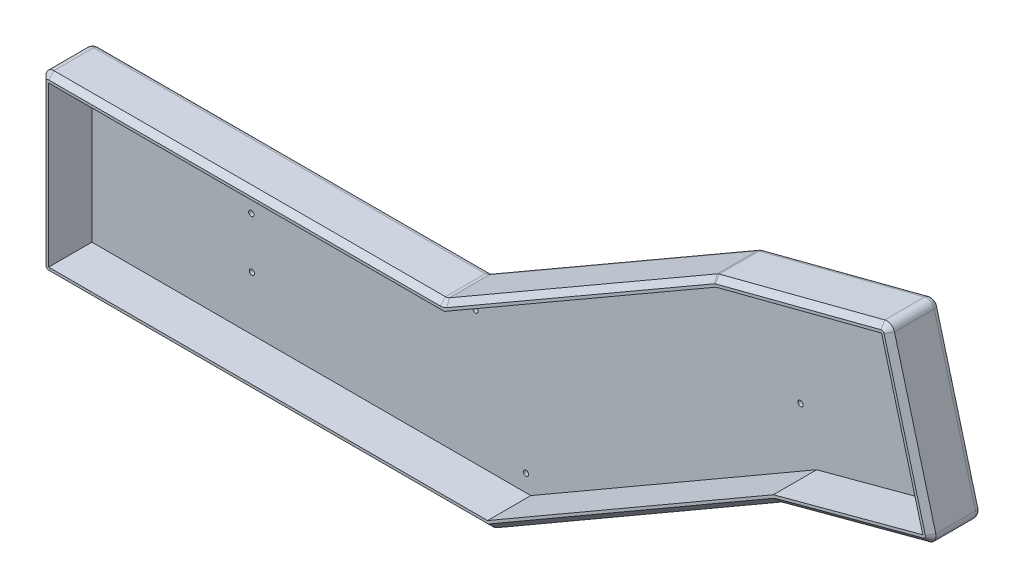
from build123d import *

# Parameters (mm, degrees)
BOSS_EXTRU_1_DEPTH      = 19
CONG_1_R                = 3
ESQUISSE1_R             = 1
BOSS_EXTRU_2_DEPTH      = 2.7
ESQUISSE2_R             = 2
ESQUISSE2_R_2           = 1
ENL_V_MAT_EXTRU_1_DEPTH = 1
CHANFREIN1_SIZE         = 2
CONG_2_R                = 2


with BuildPart() as part:
    # Model → Boss.-Extru.1 (new body)
    with BuildSketch(Plane.XY):
        Polygon((-25.928539703, 10.301582208), (76.096991945, 69.210096437), (141.828136311, 86.310332452), (158.934643692, 22.435471273), (100.081941761, 6.672683012), (-8.057042666, -55.858487698), (-177.373873722, -55.858487698), (-177.373873722, -50.687645053), (-177.373873722, 10.291172324), align=None)
        Polygon((-25.124548608, 7.301637465), (-174.373873722, 7.291378528), (-174.373873722, -50.687645053), (-174.373873722, -52.858487698), (-8.861972593, -52.858487698), (98.923133978, 9.468053786), (155.26069475, 24.557200291), (139.700811798, 82.657041562), (77.245358051, 66.408990356), align=None, mode=Mode.SUBTRACT)
    extrude(amount=BOSS_EXTRU_1_DEPTH)

    # Congé1
    cong_1_edges = [part.edges().sort_by_distance(p)[0] for p in [
        (76.096991945, 69.210096437, 9.5),
        (141.828136311, 86.310332452, 9.5),
        (158.934643692, 22.435471273, 9.5),
        (100.081941761, 6.672683012, 9.5),
        (-8.057042666, -55.858487698, 9.5),
        (-177.373873722, -55.858487698, 9.5),
        (-177.373873722, 10.291172324, 9.5),
        (-25.928539703, 10.301582208, 9.5),
    ]]
    fillet(cong_1_edges, radius=CONG_1_R)

    # Esquisse1 → Boss.-Extru.2 (add)
    with BuildSketch(Plane.XY):
        Polygon((-25.124548608, 7.301637465), (-174.373873722, 7.291378528), (-174.373873722, -50.687645053), (-174.373873722, -52.858487698), (-8.861972593, -52.858487698), (98.923133978, 9.468053786), (155.26069475, 24.557200291), (139.700811798, 82.657041562), (77.245358051, 66.408990356), align=None)
        with Locations(Location((-114.259444544, -13.418125698, 0), (0, 0, 180))):
            Circle(ESQUISSE1_R, mode=Mode.SUBTRACT)
        with Locations(Location((-114.030844544, -32.493525698, 0), (0, 0, 180))):
            Circle(ESQUISSE1_R, mode=Mode.SUBTRACT)
        with Locations(Location((-29.702844544, -2.648525698, 0), (0, 0, 180))):
            Circle(ESQUISSE1_R, mode=Mode.SUBTRACT)
        with Locations(Location((-10.652844544, -46.438125698, 0), (0, 0, 180))):
            Circle(ESQUISSE1_R, mode=Mode.SUBTRACT)
        with Locations(Location((80.685555456, 58.489274302, 0), (0, 0, 180))):
            Circle(ESQUISSE1_R, mode=Mode.SUBTRACT)
        with Locations(Location((92.877555456, 28.085474302, 0), (0, 0, 180))):
            Circle(ESQUISSE1_R, mode=Mode.SUBTRACT)
    extrude(amount=BOSS_EXTRU_2_DEPTH)

    # Esquisse2 → Enlèv. mat.-Extru.1 (cut)
    # profile 1 of 6: a face of its own
    with BuildSketch(Plane(origin=(0, 0, 0), x_dir=(-1, 0, 0), z_dir=(0, 0, -1))):
        with Locations((-80.685555456, 58.489274302)):
            Circle(ESQUISSE2_R)
        with Locations((-80.685555456, 58.489274302)):
            Circle(ESQUISSE2_R_2, mode=Mode.SUBTRACT)
    # profile 2 of 6: a face of its own
    with BuildSketch(Plane(origin=(0, 0, 0), x_dir=(-1, 0, 0), z_dir=(0, 0, -1))):
        with Locations((-92.877555456, 28.085474302)):
            Circle(ESQUISSE2_R)
        with Locations((-92.877555456, 28.085474302)):
            Circle(ESQUISSE2_R_2, mode=Mode.SUBTRACT)
    # profile 3 of 6: a face of its own
    with BuildSketch(Plane(origin=(0, 0, 0), x_dir=(-1, 0, 0), z_dir=(0, 0, -1))):
        with Locations((29.702844544, -2.648525698)):
            Circle(ESQUISSE2_R)
        with Locations((29.702844544, -2.648525698)):
            Circle(ESQUISSE2_R_2, mode=Mode.SUBTRACT)
    # profile 4 of 6: a face of its own
    with BuildSketch(Plane(origin=(0, 0, 0), x_dir=(-1, 0, 0), z_dir=(0, 0, -1))):
        with Locations((10.652844544, -46.438125698)):
            Circle(ESQUISSE2_R)
        with Locations((10.652844544, -46.438125698)):
            Circle(ESQUISSE2_R_2, mode=Mode.SUBTRACT)
    # profile 5 of 6: a face of its own
    with BuildSketch(Plane(origin=(0, 0, 0), x_dir=(-1, 0, 0), z_dir=(0, 0, -1))):
        with Locations((114.259444544, -13.418125698)):
            Circle(ESQUISSE2_R)
        with Locations((114.259444544, -13.418125698)):
            Circle(ESQUISSE2_R_2, mode=Mode.SUBTRACT)
    # profile 6 of 6: a face of its own
    with BuildSketch(Plane(origin=(0, 0, 0), x_dir=(-1, 0, 0), z_dir=(0, 0, -1))):
        with Locations((114.030844544, -32.493525698)):
            Circle(ESQUISSE2_R)
        with Locations((114.030844544, -32.493525698)):
            Circle(ESQUISSE2_R_2, mode=Mode.SUBTRACT)
    extrude(amount=-ENL_V_MAT_EXTRU_1_DEPTH, mode=Mode.SUBTRACT)

    # Chanfrein1
    chanfrein1_edges = [part.edges().sort_by_distance(p)[0] for p in [
        (-100.55320226, 10.296452739, 19),
        (25.256413626, 39.855258654, 19),
        (107.717763914, 77.436374389, 19),
        (-177.373873722, -22.783554585, 19),
        (-91.617923158, -55.858487698, 19),
        (46.189388475, -24.49058773, 19),
        (128.250722147, 14.217256264, 19),
        (150.378629519, 54.383209367, 19),
        (-176.495266971, 9.412625963, 19),
        (-176.495194066, -54.979808041, 19),
        (-8.084540154, -55.756003669, 19),
        (157.858595311, 23.056896097, 19),
        (141.210432656, 85.249539366, 19),
        (76.107372343, 69.184776466, 19),
        (-25.955930978, 10.403787708, 19),
        (100.091914608, 6.648625697, 19),
    ]]
    chamfer(chanfrein1_edges, length=CHANFREIN1_SIZE)

    # Congé2
    cong_2_edges = [part.edges().sort_by_distance(p)[0] for p in [
        (-100.55320226, 10.296452739, 0),
        (25.256413626, 39.855258654, 0),
        (107.717763914, 77.436374389, 0),
        (150.378629519, 54.383209367, 0),
        (128.250722147, 14.217256264, 0),
        (46.189388475, -24.49058773, 0),
        (-91.617923158, -55.858487698, 0),
        (-177.373873722, -22.783554585, 0),
        (-176.495266971, 9.412625963, 0),
        (-176.495194066, -54.979808041, 0),
        (-8.084540154, -55.756003669, 0),
        (157.858595311, 23.056896097, 0),
        (141.210432656, 85.249539366, 0),
        (76.107372343, 69.184776466, 0),
        (-25.955930978, 10.403787708, 0),
        (100.091914608, 6.648625697, 0),
    ]]
    fillet(cong_2_edges, radius=CONG_2_R)


solid = part.part
